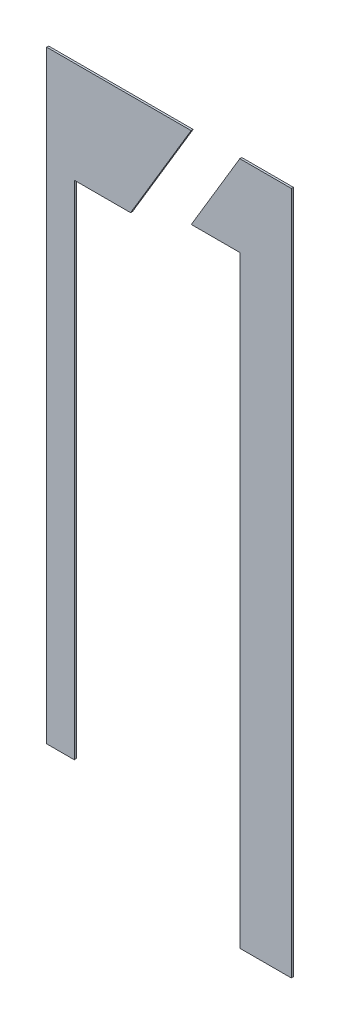
from build123d import *

# Parameters (mm, degrees)
BOSS_EXTRUDE2_DEPTH   = 0.5
BOSS_EXTRUDE2_2_DEPTH = 0.5


with BuildPart() as part:
    # Sketch3 → Boss-Extrude2 (new body)
    with BuildSketch(Plane.XY):
        Polygon((12.133808438, 28.665583791), (24.198924842, 48.865170223), (37.00195168, 48.865170223), (37.00195168, -121.134829777), (24.198924842, -121.134829777), (24.198924842, 28.665583791), align=None)
    extrude(amount=BOSS_EXTRUDE2_DEPTH)


with BuildPart() as body_2:
    # Sketch3 → Boss-Extrude2 2 (new body)
    with BuildSketch(Plane.XY):
        Polygon((-2.956949729, 23.655705163), (12.100543229, 48.865170223), (-23.814949729, 48.865170223), (-23.814949729, -101.134829777), (-16.956949729, -101.134829777), (-16.956949729, 23.655705163), align=None)
    extrude(amount=BOSS_EXTRUDE2_2_DEPTH)


solid = Compound([part.part, body_2.part])
